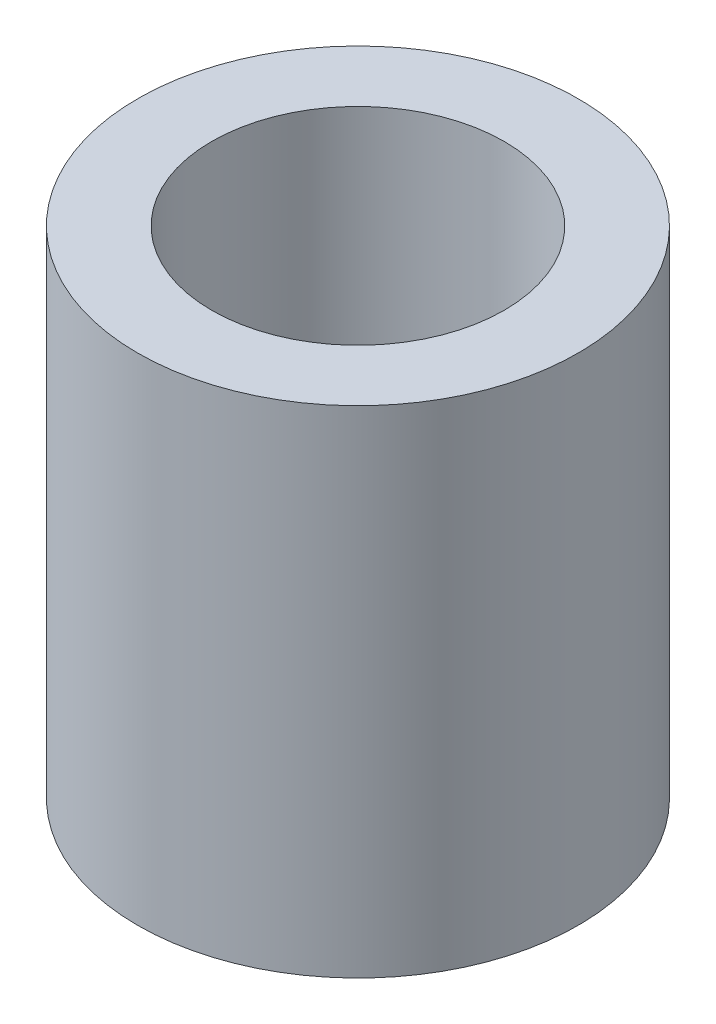
from build123d import *

# Parameters (mm, degrees)
SKETCH1_R           = 3.175
SKETCH1_R_2         = 2.1082
BOSS_EXTRUDE1_DEPTH = 7.14375


with BuildPart() as part:
    # Sketch1 → Boss-Extrude1 (new body)
    with BuildSketch(Plane(origin=(0, 0, 0), x_dir=(1, 0, 0), z_dir=(0, 1, 0))):
        with Locations(Location((0, 0, 0), (0, 0, 270))):
            Circle(SKETCH1_R)
        with Locations(Location((0, 0, 0), (0, 0, 270))):
            Circle(SKETCH1_R_2, mode=Mode.SUBTRACT)
    extrude(amount=BOSS_EXTRUDE1_DEPTH)


solid = part.part
